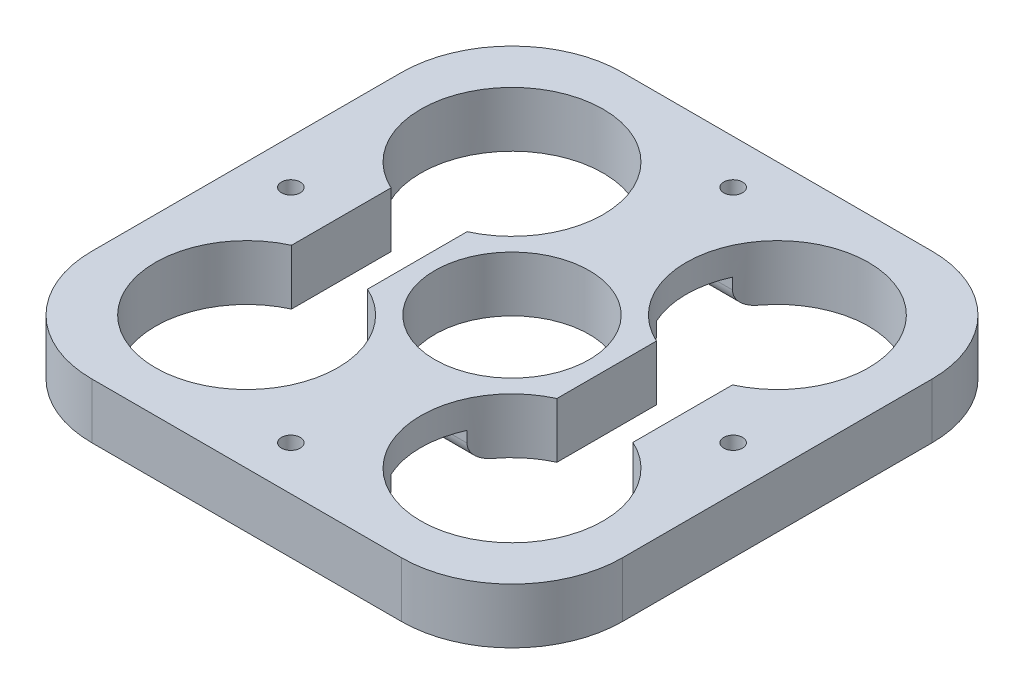
from build123d import *

# Parameters (mm, degrees)
SKETCH1_W                      = 96
SKETCH1_H                      = 96
SKETCH1_R                      = 16.5
SKETCH1_R_2                    = 13.97
BOSS_EXTRUDE1_DEPTH            = 10
FILLET1_R                      = 20
M3_CLEARANCE_HOLE1_D           = 3.4
M3_CLEARANCE_HOLE1_CSINK_D     = 3.45
M3_CLEARANCE_HOLE1_CSINK_ANGLE = 90
CUT_EXTRUDE1_DEPTH             = 5
FILLET2_R                      = 3
CUT_EXTRUDE2_DEPTH             = 69.614867208


with BuildPart() as part:
    # Sketch1 → Boss-Extrude1 (new body)
    with BuildSketch(Plane(origin=(0, 0, 0), x_dir=(1, 0, 0), z_dir=(0, 1, 0))):
        Rectangle(SKETCH1_W, SKETCH1_H)
        with Locations((-24, 24)):
            Circle(SKETCH1_R, mode=Mode.SUBTRACT)
        with Locations((24, 24)):
            Circle(SKETCH1_R, mode=Mode.SUBTRACT)
        with Locations((24, -24)):
            Circle(SKETCH1_R, mode=Mode.SUBTRACT)
        with Locations((-24, -24)):
            Circle(SKETCH1_R, mode=Mode.SUBTRACT)
        Circle(SKETCH1_R_2, mode=Mode.SUBTRACT)
    extrude(amount=BOSS_EXTRUDE1_DEPTH)

    # Fillet1
    fillet1_edges = [part.edges().sort_by_distance(p)[0] for p in [
        (-48, 5, -48),
        (48, 5, -48),
        (48, 5, 48),
        (-48, 5, 48),
    ]]
    fillet(fillet1_edges, radius=FILLET1_R)

    # M3 Clearance Hole1 (through all)
    with Locations(Plane(origin=(-40, 0, 0), x_dir=(0, 0, -1), z_dir=(0, -1, 0))):
        with Locations((0, 0), (-40, 40), (0, 80), (40, 40)):
            CounterSinkHole(M3_CLEARANCE_HOLE1_D / 2, M3_CLEARANCE_HOLE1_CSINK_D / 2, counter_sink_angle=M3_CLEARANCE_HOLE1_CSINK_ANGLE)

    # Sketch7 → Cut-Extrude1 (cut)
    with BuildSketch(Plane.XZ):
        with BuildLine():
            Line((-9, 17.126136458), (9, 17.126136458))
            ThreePointArc((9, 17.126136458), (7.5, 24), (9, 30.873863542))
            Line((9, 30.873863542), (-9, 30.873863542))
            ThreePointArc((-9, 30.873863542), (-7.5, 24), (-9, 17.126136458))
        make_face()
        with BuildLine():
            ThreePointArc((9, -30.873863542), (7.5, -24), (9, -17.126136458))
            Line((9, -17.126136458), (-9, -17.126136458))
            ThreePointArc((-9, -17.126136458), (-7.5, -24), (-9, -30.873863542))
            Line((-9, -30.873863542), (9, -30.873863542))
        make_face()
    extrude(amount=-CUT_EXTRUDE1_DEPTH, mode=Mode.SUBTRACT)

    # Fillet2
    fillet2_edges = [part.edges().sort_by_distance(p)[0] for p in [
        (0, 0, -30.873863542),
        (0, 0, -17.126136458),
        (0, 0, 30.873863542),
        (0, 0, 17.126136458),
    ]]
    fillet(fillet2_edges, radius=FILLET2_R)

    # Sketch7<3> → Cut-Extrude2 (cut, through all)
    with BuildSketch(Plane.XZ):
        with BuildLine():
            Line((30.873863542, -9), (30.873863542, 9))
            ThreePointArc((30.873863542, 9), (24, 7.5), (17.126136458, 9))
            Line((17.126136458, 9), (17.126136458, -9))
            ThreePointArc((17.126136458, -9), (24, -7.5), (30.873863542, -9))
        make_face()
        with BuildLine():
            Line((-17.126136458, -9), (-17.126136458, 9))
            ThreePointArc((-17.126136458, 9), (-24, 7.5), (-30.873863542, 9))
            Line((-30.873863542, 9), (-30.873863542, -9))
            ThreePointArc((-30.873863542, -9), (-24, -7.5), (-17.126136458, -9))
        make_face()
    extrude(amount=-CUT_EXTRUDE2_DEPTH, mode=Mode.SUBTRACT)


solid = part.part
